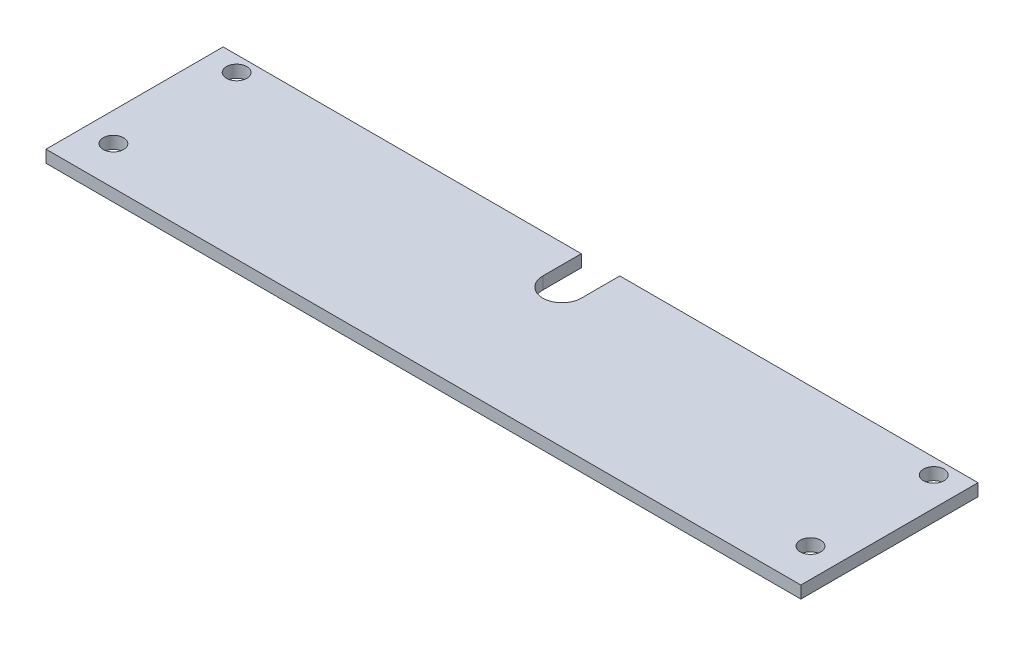
from build123d import *

# Parameters (mm, degrees)
SKETCH1_W            = 196
SKETCH1_H            = 46
BOSS_EXTRUDE1_DEPTH  = 3.175
SKETCH2_W            = 10
SKETCH2_H            = 10
CUT_EXTRUDE1_DEPTH   = 3.175
M5_CLEARANCE_HOLE1_D = 5.3


with BuildPart() as part:
    # Sketch1 → Boss-Extrude1 (new body)
    with BuildSketch(Plane(origin=(0, 0, 0), x_dir=(1, 0, 0), z_dir=(0, 1, 0))):
        with Locations((98, 23)):
            Rectangle(SKETCH1_W, SKETCH1_H)
    extrude(amount=BOSS_EXTRUDE1_DEPTH)

    # Sketch2 → Cut-Extrude1 (cut)
    with BuildSketch(Plane(origin=(0, 3.175, 0), x_dir=(1, 0, 0), z_dir=(0, 1, 0))):
        with Locations((98, 41)):
            Rectangle(SKETCH2_W, SKETCH2_H)
        with BuildLine():
            ThreePointArc((93, 36), (98, 31), (103, 36))
            Line((103, 36), (93, 36))
        make_face()
    extrude(amount=-CUT_EXTRUDE1_DEPTH, mode=Mode.SUBTRACT)

    # M5 Clearance Hole1 (through all)
    with Locations(Plane(origin=(0, 3.175, 0), x_dir=(1, 0, 0), z_dir=(0, 1, 0))):
        with Locations((188.5, 10), (7.5, 10), (188.5, 42), (7.5, 42)):
            Hole(M5_CLEARANCE_HOLE1_D / 2)


solid = part.part
